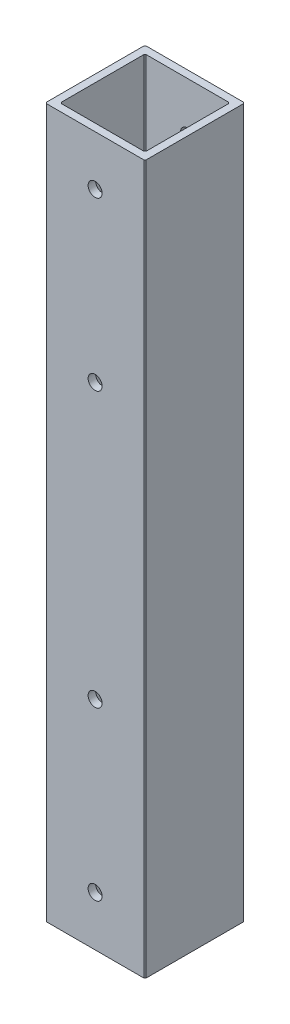
from build123d import *

# Parameters (mm, degrees)
SKETCH1_W                      = 284
SKETCH1_H                      = 40
BOSS_EXTRUDE1_DEPTH            = 40
SKETCH2_W                      = 34
SKETCH2_H                      = 34
CUT_EXTRUDE1_DEPTH             = 397.429060489
F_5_6_5_6_DIAMETER_HOLE1_D     = 5.6
F_5_6_5_6_DIAMETER_HOLE1_DEPTH = 3
F_5_6_5_6_DIAMETER_HOLE2_D     = 5.6
CHAMFER1_SIZE                  = 0.5


with BuildPart() as part:
    # Sketch1 → Boss-Extrude1 (new body)
    with BuildSketch(Plane(origin=(170, 0, 0), x_dir=(0, -1, 0), z_dir=(-1, 0, 0))):
        with Locations((0, 160)):
            Rectangle(SKETCH1_W, SKETCH1_H)
    extrude(amount=-BOSS_EXTRUDE1_DEPTH)

    # Sketch2 → Cut-Extrude1 (cut, through all)
    with BuildSketch(Plane.XZ.offset(142)):
        with Locations((190, 160)):
            Rectangle(SKETCH2_W, SKETCH2_H)
    extrude(amount=-CUT_EXTRUDE1_DEPTH, mode=Mode.SUBTRACT)

    # Ø5.6 (5.6) Diameter Hole1
    with Locations(Plane(origin=(0, 0, 140), x_dir=(-1, 0, 0), z_dir=(0, 0, -1))):
        with Locations((-190, 122), (-190, 55), (-190, -55), (-190, -122)):
            Hole(F_5_6_5_6_DIAMETER_HOLE1_D / 2, depth=F_5_6_5_6_DIAMETER_HOLE1_DEPTH)

    # Ø5.6 (5.6) Diameter Hole2 (through all)
    with Locations(Plane(origin=(0, 0, 177), x_dir=(-1, 0, 0), z_dir=(0, 0, -1))):
        with Locations((-190, 122), (-190, 55), (-190, -55), (-190, -122)):
            Hole(F_5_6_5_6_DIAMETER_HOLE2_D / 2)

    # Chamfer1
    chamfer1_edges = [part.edges().sort_by_distance(p)[0] for p in [
        (210, 0, 140),
        (207, 0, 143),
        (173, 0, 143),
        (173, 0, 177),
        (207, 0, 177),
        (210, 0, 180),
        (170, 0, 140),
        (170, 0, 180),
    ]]
    chamfer(chamfer1_edges, length=CHAMFER1_SIZE)


solid = part.part
